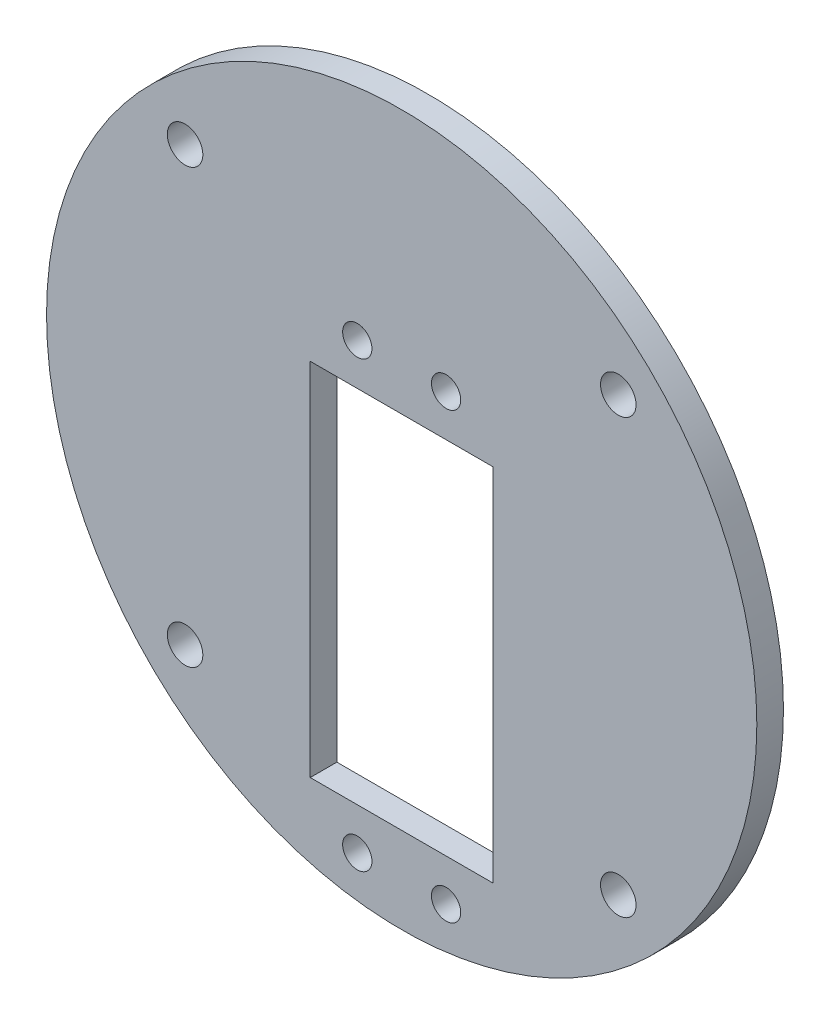
from build123d import *

# Parameters (mm, degrees)
PLATE_D80_HOLES_D4_DIAGONAL69_R      = 40
PLATE_D80_HOLES_D4_DIAGONAL69_R_2    = 2
PLATE_3MM_DEPTH                      = 3
SERVO_HOUSING_THROUGH_CUT_START      = -0.1
SERVO_HOUSING_PROFILE_40P6X20P6_W    = 20.6
SERVO_HOUSING_PROFILE_40P6X20P6_H    = 40.6
SERVO_HOUSING_THROUGH_CUT_DEPTH      = 3.2
SERVO_4XD3P3_THROUGH_HOLES_START     = -0.1
SERVO_EARS_50X10_CENTERED_ON_SHAFT_R = 1.65
SERVO_4XD3P3_THROUGH_HOLES_DEPTH     = 3.2


with BuildPart() as part:
    # Plate_D80_Holes_D4_Diagonal69 → Plate_3mm (new body)
    with BuildSketch(Plane.XY):
        Circle(PLATE_D80_HOLES_D4_DIAGONAL69_R)
        with Locations((-24.395183951, -24.395183951)):
            Circle(PLATE_D80_HOLES_D4_DIAGONAL69_R_2, mode=Mode.SUBTRACT)
        with Locations((-24.395183951, 24.395183951)):
            Circle(PLATE_D80_HOLES_D4_DIAGONAL69_R_2, mode=Mode.SUBTRACT)
        with Locations((24.395183951, -24.395183951)):
            Circle(PLATE_D80_HOLES_D4_DIAGONAL69_R_2, mode=Mode.SUBTRACT)
        with Locations((24.395183951, 24.395183951)):
            Circle(PLATE_D80_HOLES_D4_DIAGONAL69_R_2, mode=Mode.SUBTRACT)
    extrude(amount=PLATE_3MM_DEPTH)

    # Servo_Housing_Profile_40p6x20p6 → Servo_Housing_Through_Cut (cut)
    with BuildSketch(Plane.XY.offset(SERVO_HOUSING_THROUGH_CUT_START)):
        with Locations((0, -10)):
            Rectangle(SERVO_HOUSING_PROFILE_40P6X20P6_W, SERVO_HOUSING_PROFILE_40P6X20P6_H)
    extrude(amount=SERVO_HOUSING_THROUGH_CUT_DEPTH, mode=Mode.SUBTRACT)

    # Servo_Ears_50x10_Centered_on_Shaft → Servo_4xD3p3_Through_Holes (cut)
    with BuildSketch(Plane.XY.offset(SERVO_4XD3P3_THROUGH_HOLES_START)):
        with Locations((-5, -35)):
            Circle(SERVO_EARS_50X10_CENTERED_ON_SHAFT_R)
        with Locations((-5, 15)):
            Circle(SERVO_EARS_50X10_CENTERED_ON_SHAFT_R)
        with Locations((5, -35)):
            Circle(SERVO_EARS_50X10_CENTERED_ON_SHAFT_R)
        with Locations((5, 15)):
            Circle(SERVO_EARS_50X10_CENTERED_ON_SHAFT_R)
    extrude(amount=SERVO_4XD3P3_THROUGH_HOLES_DEPTH, mode=Mode.SUBTRACT)


solid = part.part
